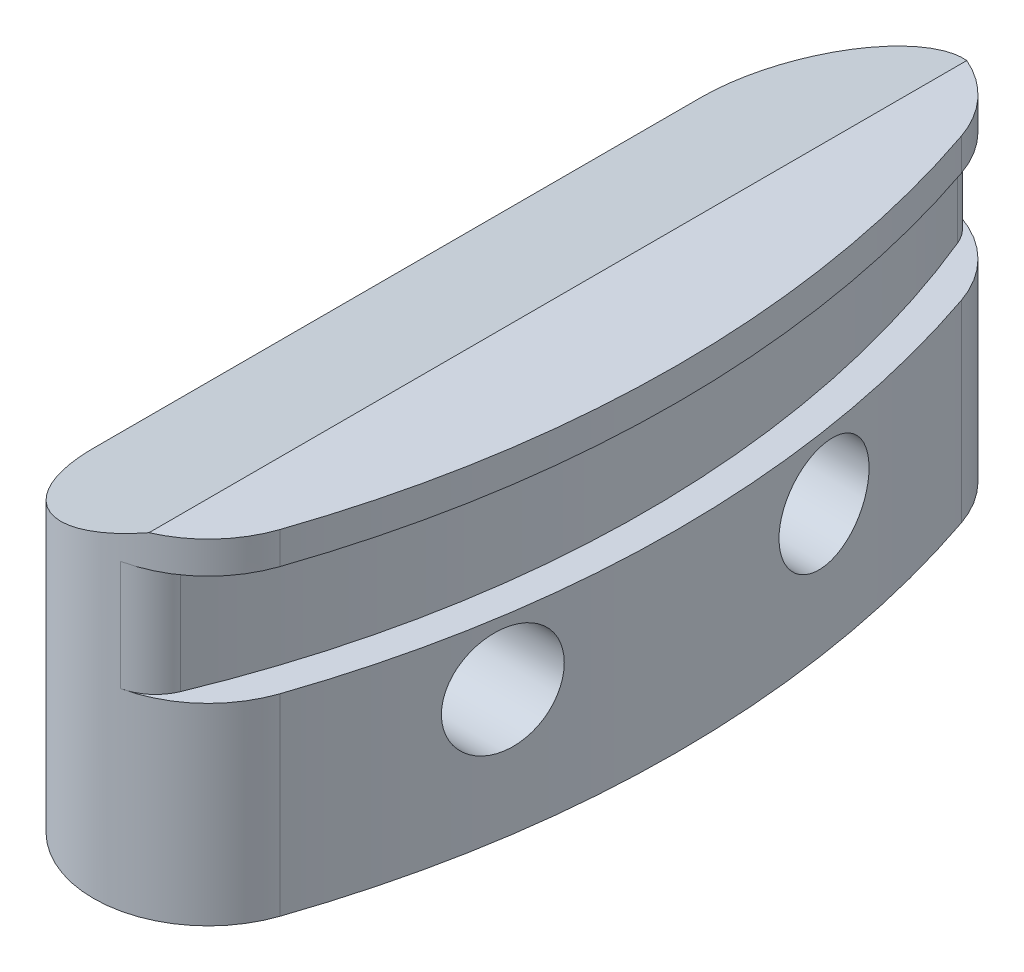
from build123d import *

# Parameters (mm, degrees)
BOSS_EXTRUDE1_DEPTH     = 9.270999999999999
CUT_EXTRUDE1_START      = -3.9369999999999994
CUT_EXTRUDE1_DEPTH      = 3.9369999999999994
BOSS_EXTRUDE3_START     = -0.889
BOSS_EXTRUDE3_DEPTH     = 0.889
F_4_CLEARANCE_HOLE1_D   = 2.9464
FILLET1_R               = 1.27
CUT_EXTRUDE2_DEPTH      = 3.8099999999999996
CUT_EXTRUDE3_DEPTH      = 33.761721331769635
CUT_EXTRUDE3_DEPTH_BACK = 33.761721331769635


with BuildPart() as part:
    # Sketch1 → Boss-Extrude1 (new body)
    with BuildSketch(Plane(origin=(0, 0, 0), x_dir=(1, 0, 0), z_dir=(0, 1, 0))):
        with BuildLine():
            ThreePointArc((27.64499611640363, 9.432830419552142), (29.21000000000004, -8.87e-15), (27.64499611640362, -9.432830419552147))
            ThreePointArc((27.64499611640362, -9.432830419552147), (23.61479757988669, -11.412413647470785), (21.635214351968056, -7.382215110953854))
            ThreePointArc((21.635214351968056, -7.382215110953854), (22.86000000000002, -4.21e-15), (21.63521435196806, 7.382215110953852))
            ThreePointArc((21.63521435196806, 7.382215110953852), (23.614797579886698, 11.412413647470782), (27.64499611640363, 9.432830419552142))
        make_face()
        with BuildLine():
            Line((21.46510523418584, 8.407522765252999), (21.46510523418584, -8.407522765253002))
            ThreePointArc((21.46510523418584, -8.407522765253002), (21.50792120774028, -7.887861121027391), (21.635214351968056, -7.382215110953854))
            ThreePointArc((21.635214351968056, -7.382215110953854), (22.860000000000017, -3.77e-15), (21.63521435196806, 7.382215110953851))
            ThreePointArc((21.63521435196806, 7.382215110953852), (21.50792120774028, 7.887861121027388), (21.46510523418585, 8.407522765252999))
        make_face()
    extrude(amount=BOSS_EXTRUDE1_DEPTH)

    # Sketch2 → Cut-Extrude1 (cut)
    with BuildSketch(Plane(origin=(0, 9.270999999999999, 0), x_dir=(1, 0, 0), z_dir=(0, 1, 0)).offset(CUT_EXTRUDE1_START)):
        with BuildLine():
            ThreePointArc((25.999489326181067, 11.27679094554398), (28.33971522883937, -1.014e-14), (25.999489326181067, -11.276790945543972))
            ThreePointArc((25.999489326181067, -11.276790945543972), (27.009023049980158, -10.521489033197938), (27.64499611640362, -9.432830419552147))
            ThreePointArc((27.64499611640362, -9.432830419552147), (29.210000000003742, -2.68e-15), (27.64499611640363, 9.432830419552143))
            ThreePointArc((27.64499611640363, 9.432830419552143), (27.00902304998017, 10.521489033197945), (25.999489326181067, 11.27679094554398))
        make_face()
    extrude(amount=CUT_EXTRUDE1_DEPTH, mode=Mode.SUBTRACT)

    # Sketch6 → Boss-Extrude3 (add)
    with BuildSketch(Plane(origin=(0, 9.270999999999999, 0), x_dir=(1, 0, 0), z_dir=(0, 1, 0)).offset(BOSS_EXTRUDE3_START)):
        with BuildLine():
            ThreePointArc((25.999489326181127, -11.276790945543995), (28.33971522883936, 3.79e-15), (25.999489326181067, 11.27679094554398))
            ThreePointArc((25.999489326181067, 11.27679094554398), (27.009023049980538, 10.521489033198275), (27.64499611640363, 9.432830419552143))
            ThreePointArc((27.64499611640363, 9.432830419552143), (29.210000000000107, 1.749e-14), (27.64499611640362, -9.432830419552147))
            ThreePointArc((27.64499611640362, -9.432830419552147), (27.009023049980552, -10.521489033198266), (25.999489326181127, -11.276790945543995))
        make_face()
    extrude(amount=BOSS_EXTRUDE3_DEPTH)

    # #4 Clearance Hole1 (through all)
    with Locations(Plane(origin=(21.465105234, 3.556, -4.445), x_dir=(0, 0, -1), z_dir=(-1, 0, 0))):
        with Locations((0, 0), (-8.89, 0)):
            Hole(F_4_CLEARANCE_HOLE1_D / 2)

    # Fillet1
    fillet1_edges = [part.edges().sort_by_distance(p)[0] for p in [
        (25.999489326181063, 6.858, -11.27679094554398),
        (25.999489326181063, 6.858, 11.27679094554397),
    ]]
    fillet(fillet1_edges, radius=FILLET1_R)

    # Sketch7 → Cut-Extrude2 (cut)
    with BuildSketch(Plane.ZY.offset(-21.46510523418584)):
        Polygon((-2.6119128953229507, 6.730999999999997), (-6.2780871046770725, 6.730999999999997), (-8.111174209354134, 3.555999999999999), (-6.278087104677075, 0.3810000000000021), (-2.611912895322953, 0.38100000000000167), (-0.778825790645891, 3.5559999999999996), align=None)
        Polygon((6.278087104677047, 6.730999999999998), (2.611912895322926, 6.730999999999998), (0.7788257906458637, 3.5559999999999996), (2.6119128953229236, 0.3810000000000003), (6.278087104677046, 0.3809999999999996), (8.111174209354107, 3.5559999999999974), align=None)
    extrude(amount=-CUT_EXTRUDE2_DEPTH, mode=Mode.SUBTRACT)

    # Sketch10 → Cut-Extrude3 (cut, two sides: drawn at the far end of the back side and taken through both)
    with BuildSketch(Plane.XY.offset(-CUT_EXTRUDE3_DEPTH_BACK)):
        Polygon((21.46510523418584, 9.270999999999999), (21.46510523418584, 7.62), (25.91010523418584, 9.270999999999999), align=None)
    extrude(amount=CUT_EXTRUDE3_DEPTH + CUT_EXTRUDE3_DEPTH_BACK, mode=Mode.SUBTRACT)


solid = part.part
